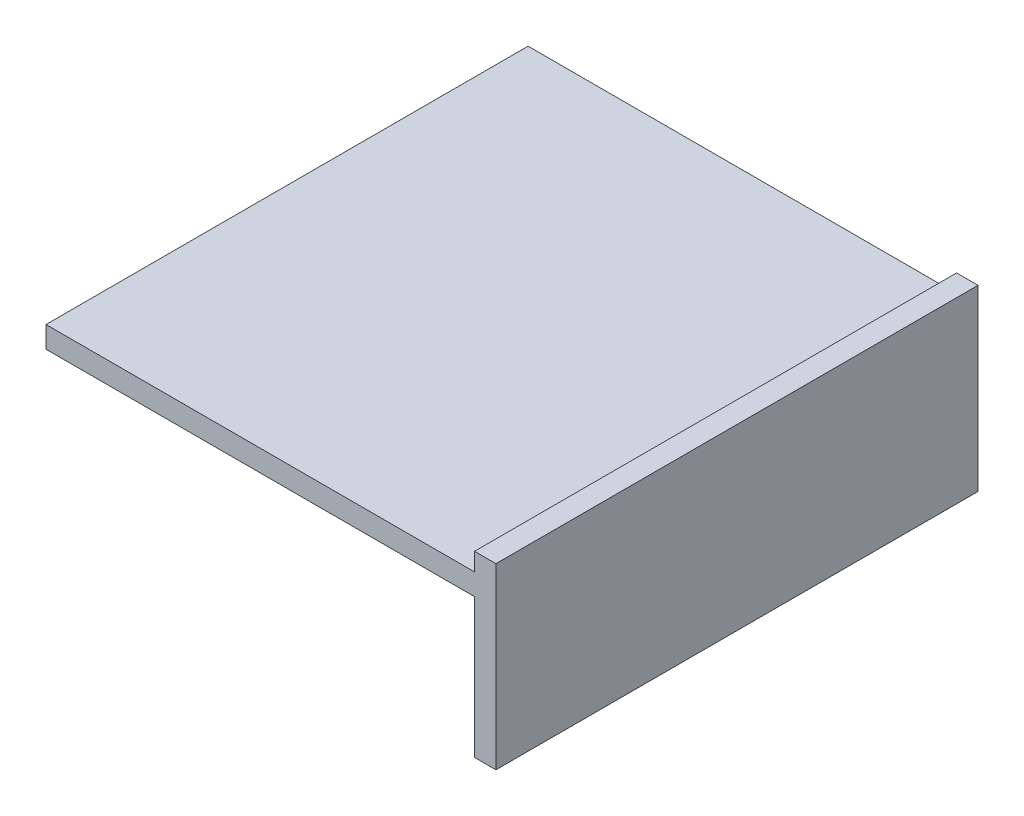
from build123d import *

# Parameters (mm, degrees)
SKETCH_2_W      = 240
SKETCH_2_H      = 270
EXTRUDE_1_DEPTH = 12
SKETCH_3_W      = 270
SKETCH_3_H      = 100
EXTRUDE_2_DEPTH = 12
SKETCH_4_W      = 12
SKETCH_4_H      = 78
EXTRUDE_3_DEPTH = 240


with BuildPart() as part:
    # 草图2 → 凸台-拉伸1 (new body)
    with BuildSketch(Plane(origin=(0, 0, 0), x_dir=(1, 0, 0), z_dir=(0, 1, 0))):
        with Locations((120, 135)):
            Rectangle(SKETCH_2_W, SKETCH_2_H)
    extrude(amount=EXTRUDE_1_DEPTH)

    # 草图3 → 凸台-拉伸2 (add)
    with BuildSketch(Plane(origin=(240, 0, 0), x_dir=(0, 0, -1), z_dir=(1, 0, 0))):
        with Locations((135, -28)):
            Rectangle(SKETCH_3_W, SKETCH_3_H)
    extrude(amount=EXTRUDE_2_DEPTH)

    # 草图4 → 凸台-拉伸3 (add)
    with BuildSketch(Plane.ZY.offset(-240)):
        with Locations((-264, -39)):
            Rectangle(SKETCH_4_W, SKETCH_4_H)
    extrude(amount=EXTRUDE_3_DEPTH)


solid = part.part
